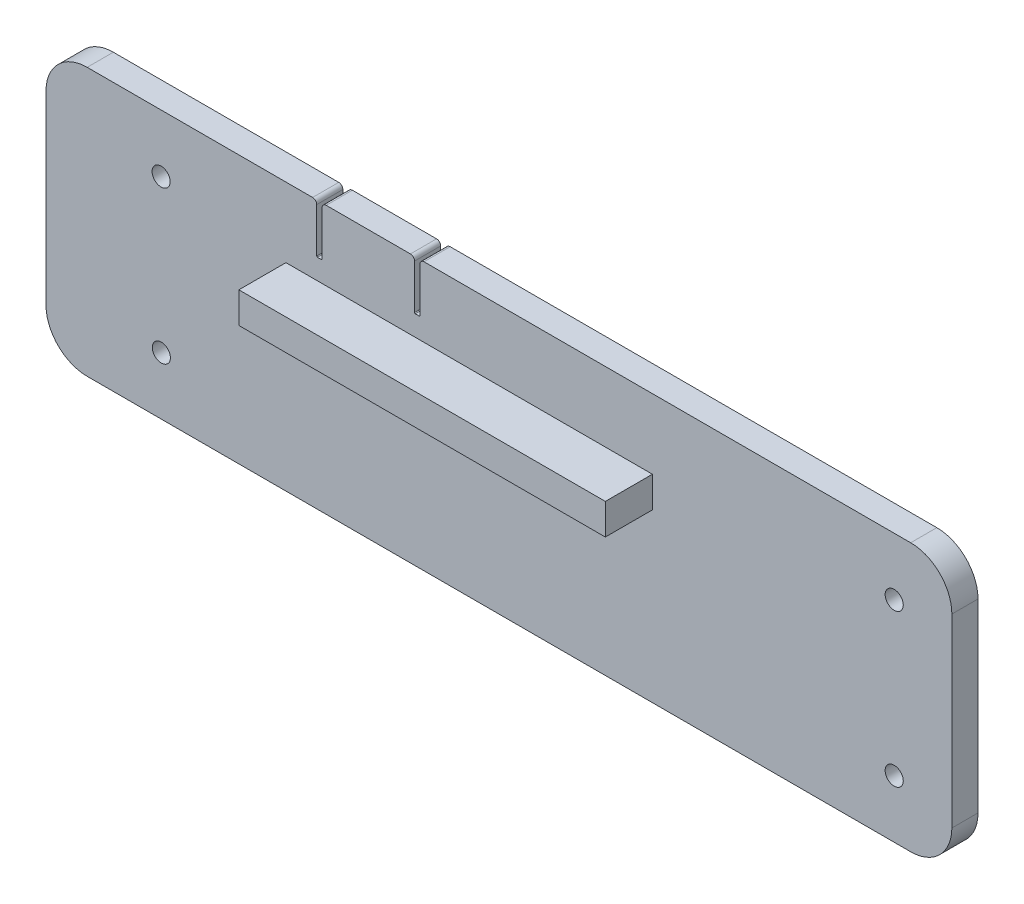
from build123d import *

# Parameters (mm, degrees)
BOSS_EXTRUDE1_DEPTH = 6.35
SKETCH2_R           = 2.20000068
CUT_EXTRUDE1_DEPTH  = 1004.989260418
SKETCH3_W           = 88.9999998
SKETCH3_H           = 7.4999977
BOSS_EXTRUDE2_DEPTH = 11.43


with BuildPart() as part:
    # 3DSketch1 → Boss-Extrude1 (new body)
    with BuildSketch(Plane(origin=(600.47776272, 523.59342576, 0), x_dir=(0.9797149309198314, 0.20039624281096213, 0), z_dir=(0, 0, 1))):
        with BuildLine():
            Line((0, 0), (9.017831215, 44.087173302))
            ThreePointArc((9.017831215, 44.087173302), (13.304365371, 50.427857212), (20.81894333, 51.880360433))
            Line((20.81894333, 51.880360433), (74.458631652, 40.908605623))
            ThreePointArc((74.458631652, 40.908605623), (75.092700365, 40.47995199), (75.237950761, 39.728493812))
            Line((75.237950761, 39.728493812), (73.073671595, 29.147573812))
            ThreePointArc((73.073671595, 29.147573812), (73.102720392, 28.99728113), (73.229534512, 28.911549561))
            Line((73.229534512, 28.911549561), (74.111278675, 28.731192794))
            ThreePointArc((74.111278675, 28.731192794), (74.261570989, 28.760243499), (74.347300947, 28.887058709))
            Line((74.347300947, 28.887058709), (76.511580113, 39.467978708))
            ThreePointArc((76.511580113, 39.467978708), (76.940233746, 40.102047422), (77.691691924, 40.247297817))
            Line((77.691691924, 40.247297817), (97.731759327, 36.148192979))
            ThreePointArc((97.731759327, 36.148192979), (98.36582804, 35.719539346), (98.511078436, 34.968081168))
            Line((98.511078436, 34.968081168), (96.34679927, 24.387161168))
            ThreePointArc((96.34679927, 24.387161168), (96.375848066, 24.236868486), (96.502662187, 24.151136917))
            Line((96.502662187, 24.151136917), (97.38440635, 23.97078015))
            ThreePointArc((97.38440635, 23.97078015), (97.534698663, 23.999830856), (97.620428621, 24.126646065))
            Line((97.620428621, 24.126646065), (99.784707787, 34.707566065))
            ThreePointArc((99.784707787, 34.707566065), (100.21336142, 35.341634778), (100.964819598, 35.486885174))
            Line((100.964819598, 35.486885174), (216.761930807, 11.801111606))
            ThreePointArc((216.761930807, 11.801111606), (223.102612928, 7.514576899), (224.555115449, 0))
            Line((224.555115449, 0), (215.537284234, -44.087173302))
            ThreePointArc((215.537284234, -44.087173302), (211.250750587, -50.427854723), (203.736175117, -51.880358453))
            Line((203.736175117, -51.880358453), (7.793187639, -11.801109626))
            ThreePointArc((7.793187639, -11.801109626), (1.45250443, -7.514576531), (0, 0))
        make_face()
    extrude(amount=-BOSS_EXTRUDE1_DEPTH)

    # Sketch2 → Cut-Extrude1 (cut, through all)
    with BuildSketch(Plane.XY):
        with Locations((806.4777622, 527.59342792)):
            Circle(SKETCH2_R)
        with Locations((806.47776474, 564.59342758)):
            Circle(SKETCH2_R)
        with Locations((628.49137192, 527.59342792)):
            Circle(SKETCH2_R)
        with Locations((628.43782872, 564.59342758)):
            Circle(SKETCH2_R)
    extrude(amount=-CUT_EXTRUDE1_DEPTH, mode=Mode.SUBTRACT)

    # Sketch3 → Boss-Extrude2 (add)
    with BuildSketch(Plane.XY):
        with Locations((703.25022672, 557.89342701)):
            Rectangle(SKETCH3_W, SKETCH3_H)
    extrude(amount=BOSS_EXTRUDE2_DEPTH)


solid = part.part
